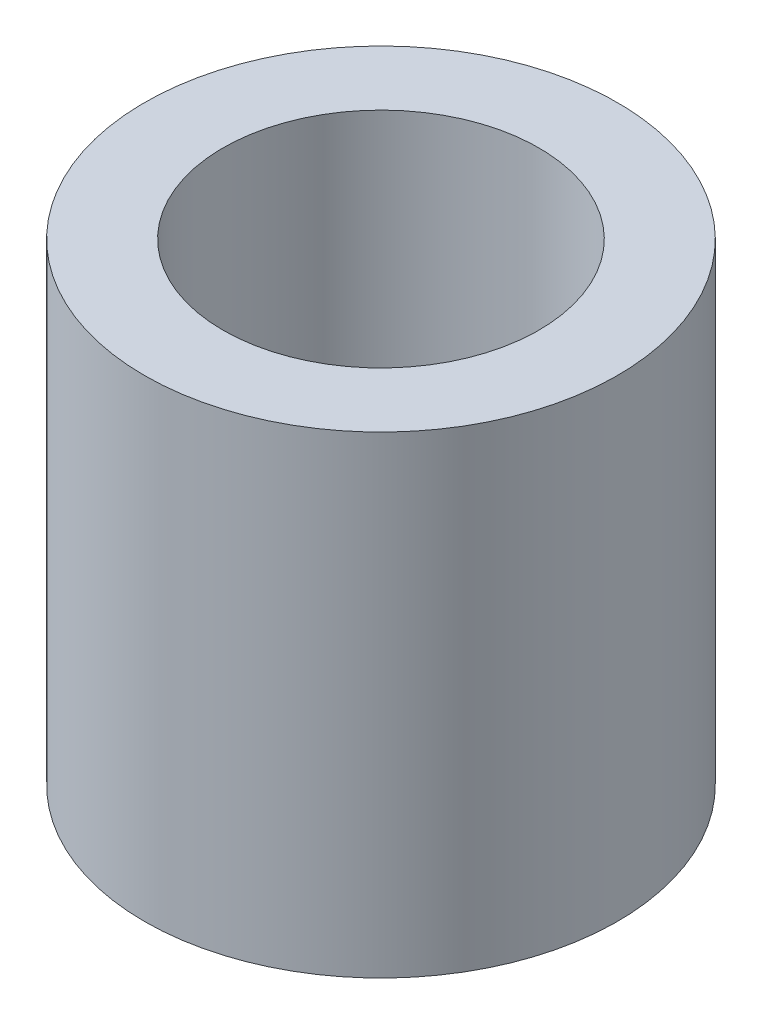
from build123d import *

# Parameters (mm, degrees)
SKETCH1_R           = 25.4
SKETCH1_R_2         = 16.968374901
BOSS_EXTRUDE1_DEPTH = 50.8


with BuildPart() as part:
    # Sketch1 → Boss-Extrude1 (new body)
    with BuildSketch(Plane(origin=(0, 0, 0), x_dir=(1, 0, 0), z_dir=(0, 1, 0))):
        with Locations(Location((0, 0, 0), (0, 0, 270))):
            Circle(SKETCH1_R)
        with Locations(Location((0, 0, 0), (0, 0, 270))):
            Circle(SKETCH1_R_2, mode=Mode.SUBTRACT)
    extrude(amount=BOSS_EXTRUDE1_DEPTH)


solid = part.part
